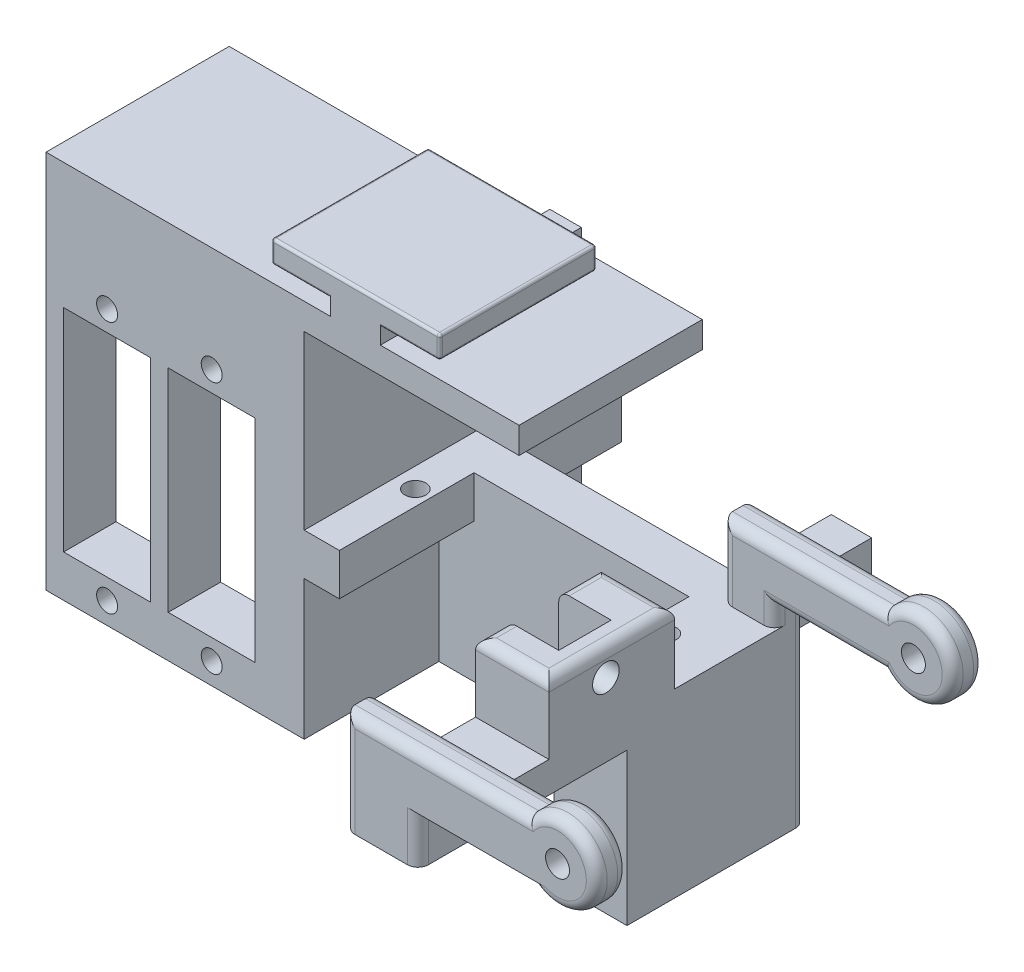
from build123d import *

# Parameters (mm, degrees)
SKETCH1_W                         = 21.64
SKETCH1_H                         = 36.2
CENTER_COLUMN_DEPTH               = 2.5
COLUMN_CAP_DEPTH                  = 55.1399964
ATTACHMENT_BLOCK_DEPTH            = 14.98
SKETCH6_W                         = 5
SKETCH6_H                         = 14.5
CENTRAL_EXTRUSION_DEPTH           = 33.79199998
WING_EXTRUSION_DEPTH              = 0.445
SKETCH10_W                        = 3.84999992
SKETCH10_H                        = 9
SERVO_TAB_EXTRUSION_DEPTH         = 9.48
SKETCH11_W                        = 9.94200006
SKETCH11_H                        = 17.28189
FRONT_TAB_EXTRUSION_DEPTH         = 11.63
SKETCH15_W                        = 10
SKETCH15_H                        = 9.5
CENTER_BLOCK_DEPTH                = 12
SKETCH16_W                        = 5
SKETCH16_H                        = 5.43
CENTER_CHASM_DEPTH                = 5
SKETCH17_R                        = 1.27
CENTER_HOLE_DEPTH                 = 60.602361575
SKETCH18_W                        = 10
SKETCH18_H                        = 2.9511752
HOLDER_ARM_DEPTH                  = 12.5
SKETCH19_W                        = 10
SKETCH19_H                        = 3
ELBOW_EXTRUSION_DEPTH             = 6.78
SKETCH27_W                        = 3
SKETCH27_H                        = 5
FOREARM_EXTRUSION_DEPTH           = 7.874
SKETCH28_R                        = 3.75
SKETCH28_R_2                      = 1.143
HAND_EXTRUSION_DEPTH              = 3
SKETCH23_W                        = 5
SKETCH23_H                        = 3
RIGHT_ELBOW_EXTRUSION_DEPTH       = 6.902
SKETCH24_W                        = 3
SKETCH24_H                        = 5
RIGHT_FOREARM_EXTRUSION_DEPTH     = 11.000000098
SKETCH25_R                        = 3.75
SKETCH25_R_2                      = 1.143
RIGHT_HAND_DEPTH                  = 3
SKETCH26_R                        = 1
SKETCH26_W                        = 8.3
SKETCH26_H                        = 20.2
REAR_SERVO_MOUNTS_DEPTH           = 70.999890195
NEW_BACK_DEPTH                    = 3
BOTTOM_SUPPORT_DEPTH              = 3
SKETCH31_W                        = 11.63
SKETCH31_H                        = 20.28189
RE_CUT_CENTRAL_CAVITY_DEPTH       = 3
SKETCH32_W                        = 9.48
SKETCH32_H                        = 9
FORM_LEFT_FRONT_REAR_BLOCK_DEPTH  = 3
SKETCH33_W                        = 20
SKETCH33_H                        = 17.28189
CREATE_CENTER_CAVITY_DEPTH        = 71.159701413
BOSS_EXTRUDE6_REACH               = 59.163
SKETCH34_W                        = 2.07
SKETCH34_H                        = 20.28189
EXTEND_WING_EXTRUSION_DEPTH       = 10.653199928
SKETCH37_W                        = 3.85
SKETCH37_H                        = 9
RIGHT_FRONT_REAR_EXTRUSION_DEPTH  = 9.48
SKETCH38_W                        = 3
SKETCH38_H                        = 12
TRIM_CENTER_BLOCK_DEPTH           = 6.5488248
SKETCH39_W                        = 3.85
SKETCH39_H                        = 9
RIGHT_FRONT_EXTENSION_DEPTH       = 7.33
TRIM_LEFT_ARM_DEPTH               = 4.7311752
SKETCH42_W                        = 23.84999992
SKETCH42_H                        = 3
CLOSE_BASE_PLATE_DEPTH            = 7.41
SKETCH43_W                        = 5.445
SKETCH43_H                        = 8.28189
SHAPE_LEFT_FRONT_BLOCK_DEPTH      = 3.84999992
SKETCH44_W                        = 3.84999992
SKETCH44_H                        = 4.555
FIX_LEFT_FRONT_CHIP_DEPTH         = 2.78189
SKETCH45_W                        = 3.85
SKETCH45_H                        = 9
ADJUST_FRONT_MOUNTING_BLOCK_DEPTH = 2.032
THICKEN_CENTER_BLOCK_DEPTH        = 2.15
SKETCH47_R                        = 1
FRONT_SERVO_MOUNTS_DEPTH          = 9
HAND_FILLETS_R                    = 1
CENTER_BLOCK_FILLET_R             = 1
CUT_EXTRUDE1_DEPTH                = 55.1399964
CUT_EXTRUDE2_START                = -30.499996
SKETCH49_W                        = 5
SKETCH49_H                        = 2.31
CUT_EXTRUDE2_DEPTH                = 30.499996
CUT_EXTRUDE3_DEPTH                = 10
CUT_EXTRUDE5_START                = -3
CUT_EXTRUDE5_DEPTH                = 3
SKETCH53_W                        = 5
SKETCH53_H                        = 2.31
CUT_EXTRUDE6_DEPTH                = 20.4999964
FILLET3_R                         = 0.25
SKETCH54_W                        = 3.85
SKETCH54_H                        = 9.362
SKETCH54_W_2                      = 3.84999992
SKETCH54_H_2                      = 12.855
CUT_EXTRUDE9_DEPTH                = 5
SKETCH55_W                        = 12.855
SKETCH55_H                        = 4
CUT_EXTRUDE10_DEPTH               = 0.5


with BuildPart() as part:
    # Sketch1 → Center Column (new, symmetric)
    with BuildSketch(Plane.XY):
        Rectangle(SKETCH1_W, SKETCH1_H)
    extrude(amount=CENTER_COLUMN_DEPTH, both=True)

    # Sketch2 → Column Cap (add)
    with BuildSketch(Plane.ZY.offset(10.82)):
        Polygon((-2.5, 18.1), (-14.98, 18.1), (-14.98, 15.6), (-10.5, 15.6), (-2.5, 10.98), (2.5, 10.98), (2.5, 18.1), align=None)
    extrude(amount=-COLUMN_CAP_DEPTH)

    # Sketch5 → Attachment Block (add)
    with BuildSketch(Plane.XY.offset(2.5)):
        Polygon((16.330000056, 18.1), (21.080000056, 18.1), (21.080000056, 19.600000018), (26.740000056, 19.600000018), (26.740000056, 21.750000018), (10.670000056, 21.750000018), (10.670000056, 19.6), (16.330000056, 19.6), align=None)
    extrude(amount=-ATTACHMENT_BLOCK_DEPTH)

    # Sketch6 → Central Extrusion (add)
    with BuildSketch(Plane(origin=(10.82, 0, 0), x_dir=(0, 0, -1), z_dir=(1, 0, 0))):
        with Locations((0, -10.85)):
            Rectangle(SKETCH6_W, SKETCH6_H)
    extrude(amount=CENTRAL_EXTRUSION_DEPTH)

    # Sketch7 → Wing Extrusion (add, symmetric)
    with BuildSketch(Plane(origin=(0, 0, -2.5), x_dir=(-1, 0, 0), z_dir=(0, 0, -1))):
        Polygon((-10.82, -18.1), (-10.82, -3.6), (-10.82, -0.81811), (-34.92, -0.81811), (-44.61199998, -0.81811), (-44.61199998, -18.1), (-40.253999996, -18.1), align=None)
    extrude(amount=WING_EXTRUSION_DEPTH, both=True)

    # Sketch10 → Servo Tab Extrusion (add)
    with BuildSketch(Plane(origin=(0, 0, -2.945), x_dir=(-1, 0, 0), z_dir=(0, 0, -1))):
        with Locations((-12.74499996, -5.31811)):
            Rectangle(SKETCH10_W, SKETCH10_H)
    extrude(amount=SERVO_TAB_EXTRUSION_DEPTH)

    # Sketch11 → Front Tab Extrusion (add)
    with BuildSketch(Plane(origin=(0, 0, -2.945), x_dir=(-1, 0, 0), z_dir=(0, 0, -1))):
        with Locations((-39.64099995, -9.459055)):
            Rectangle(SKETCH11_W, SKETCH11_H)
    extrude(amount=FRONT_TAB_EXTRUSION_DEPTH)

    # Sketch15 → Center Block (add)
    with BuildSketch(Plane.XY.offset(-2.055)):
        with Locations((42.611999818, 1.15)):
            Rectangle(SKETCH15_W, SKETCH15_H)
    extrude(amount=CENTER_BLOCK_DEPTH)

    # Sketch16 → Center Chasm (cut)
    with BuildSketch(Plane.ZY.offset(-37.611999818)):
        with Locations((4.509, 3.185)):
            Rectangle(SKETCH16_W, SKETCH16_H)
    extrude(amount=-CENTER_CHASM_DEPTH, mode=Mode.SUBTRACT)

    # Sketch17 → Center Hole (cut, through all)
    with BuildSketch(Plane.ZY.offset(-42.611999818)):
        with Locations((4.509, 3.4)):
            Circle(SKETCH17_R)
    extrude(amount=-CENTER_HOLE_DEPTH, mode=Mode.SUBTRACT)

    # Sketch18 → Holder Arm (add)
    with BuildSketch(Plane.XY.offset(9.945)):
        with Locations((42.611999818, -2.1244124)):
            Rectangle(SKETCH18_W, SKETCH18_H)
    extrude(amount=HOLDER_ARM_DEPTH)

    # Sketch19 → Elbow Extrusion (add)
    with BuildSketch(Plane(origin=(0, -0.6488248, 0), x_dir=(1, 0, 0), z_dir=(0, 1, 0))):
        with Locations((42.611999818, -20.945)):
            Rectangle(SKETCH19_W, SKETCH19_H)
    extrude(amount=ELBOW_EXTRUSION_DEPTH)

    # Sketch27 → Forearm Extrusion (add)
    with BuildSketch(Plane(origin=(47.611999818, 0, 0), x_dir=(0, 0, -1), z_dir=(1, 0, 0))):
        with Locations((-20.945, 3.6311752)):
            Rectangle(SKETCH27_W, SKETCH27_H)
    extrude(amount=FOREARM_EXTRUSION_DEPTH)

    # Sketch28 → Hand Extrusion (add)
    with BuildSketch(Plane.XY.offset(22.445)):
        with Locations((57.931999818, 3.6311752)):
            Circle(SKETCH28_R)
        with Locations((57.931999818, 3.6311752)):
            Circle(SKETCH28_R_2, mode=Mode.SUBTRACT)
    extrude(amount=-HAND_EXTRUSION_DEPTH)

    # Sketch23 → Right Elbow Extrusion (add)
    with BuildSketch(Plane(origin=(0, -0.81811, 0), x_dir=(1, 0, 0), z_dir=(0, 1, 0))):
        with Locations((42.11199998, 13.075)):
            Rectangle(SKETCH23_W, SKETCH23_H)
    extrude(amount=RIGHT_ELBOW_EXTRUSION_DEPTH)

    # Sketch24 → Right Forearm Extrusion (add)
    with BuildSketch(Plane(origin=(44.61199998, 0, 0), x_dir=(0, 0, -1), z_dir=(1, 0, 0))):
        with Locations((13.075, 3.58389)):
            Rectangle(SKETCH24_W, SKETCH24_H)
    extrude(amount=RIGHT_FOREARM_EXTRUSION_DEPTH)

    # Sketch25 → Right Hand (add)
    with BuildSketch(Plane(origin=(0, 0, -14.575), x_dir=(-1, 0, 0), z_dir=(0, 0, -1))):
        with Locations((-57.87000432, 3.58389)):
            Circle(SKETCH25_R)
        with Locations((-57.87000432, 3.58389)):
            Circle(SKETCH25_R_2, mode=Mode.SUBTRACT)
    extrude(amount=-RIGHT_HAND_DEPTH)

    # Sketch26 → Rear Servo Mounts (cut, through all)
    with BuildSketch(Plane(origin=(0, 0, -2.5), x_dir=(-1, 0, 0), z_dir=(0, 0, -1))):
        with Locations((-4.99, 8.05)):
            Circle(SKETCH26_R)
        with Locations((4.99, 8.05)):
            Circle(SKETCH26_R)
        with Locations((-4.99, -16.05)):
            Circle(SKETCH26_R)
        with Locations((4.99, -16.05)):
            Circle(SKETCH26_R)
        with Locations((4.99, -4)):
            Rectangle(SKETCH26_W, SKETCH26_H)
        with Locations((-4.99, -4)):
            Rectangle(SKETCH26_W, SKETCH26_H)
    extrude(amount=-REAR_SERVO_MOUNTS_DEPTH, mode=Mode.SUBTRACT)

    # Sketch29 → New Back (add)
    with BuildSketch(Plane(origin=(10.82, 0, 0), x_dir=(0, 0, -1), z_dir=(1, 0, 0))):
        Polygon((-2.5, 10.98), (19.745, 10.98), (19.745, -18.1), (2.945, -18.1), (-2.5, -18.1), align=None)
    extrude(amount=NEW_BACK_DEPTH)

    # Sketch30 → Bottom Support (add)
    with BuildSketch(Plane.XZ.offset(18.1)):
        Polygon((10.82, -19.745), (13.82, -19.745), (13.82, -2.945), (34.66999992, -2.945), (34.66999992, -14.575), (44.61199998, -14.575), (44.61199998, 2.5), (-10.82, 2.5), (-10.82, -2.5), (10.82, -2.5), align=None)
    extrude(amount=BOTTOM_SUPPORT_DEPTH)

    # Sketch31 → Re-cut Central Cavity (cut)
    with BuildSketch(Plane.ZY.offset(-34.66999992)):
        with Locations((-8.76, -10.959055)):
            Rectangle(SKETCH31_W, SKETCH31_H)
    extrude(amount=-RE_CUT_CENTRAL_CAVITY_DEPTH, mode=Mode.SUBTRACT)

    # Sketch32 → Form Left Front-Rear Block (add)
    with BuildSketch(Plane(origin=(14.66999992, 0, 0), x_dir=(0, 0, -1), z_dir=(1, 0, 0))):
        with Locations((7.685, -5.31811)):
            Rectangle(SKETCH32_W, SKETCH32_H)
    extrude(amount=FORM_LEFT_FRONT_REAR_BLOCK_DEPTH)

    # Sketch33 → Create Center Cavity (cut, through all)
    with BuildSketch(Plane(origin=(0, 0, -2.945), x_dir=(-1, 0, 0), z_dir=(0, 0, -1))):
        with Locations((-27.66999992, -9.459055)):
            Rectangle(SKETCH33_W, SKETCH33_H)
    extrude(amount=-CREATE_CENTER_CAVITY_DEPTH, mode=Mode.SUBTRACT)

    # Boss-Extrude6: up to this face of the body (flat: up to its plane)
    boss_extrude6_end = Plane(part.part.faces().sort_by_distance((37.66999992, -9.333369288, -3.619536704))[0])
    # Sketch34 → Boss-Extrude6 (add, up to the picked face)
    with BuildSketch(Plane(origin=(13.82, 0, 0), x_dir=(0, 0, -1), z_dir=(1, 0, 0)), mode=Mode.PRIVATE) as boss_extrude6_sk1:
        with Locations((11.39, -10.959055)):
            Rectangle(SKETCH34_W, SKETCH34_H)
    boss_extrude6_tool1 = split(extrude(boss_extrude6_sk1.sketch, amount=BOSS_EXTRUDE6_REACH, mode=Mode.PRIVATE), bisect_by=boss_extrude6_end, keep=Keep.BOTH, mode=Mode.PRIVATE)
    add(boss_extrude6_tool1.solids().sort_by(Axis((13.82, -10.959055, -11.39), (1, 0, 0)))[0])

    # Sketch35 → Extend Wing Extrusion (add)
    with BuildSketch(Plane(origin=(0, 0, -12.425), x_dir=(-1, 0, 0), z_dir=(0, 0, -1))):
        Polygon((-13.82, -0.81811), (-13.82, -21.1), (-10.819999904, -21.1), (-10.819999904, 10.98), (-13.82, 10.98), align=None)
    extrude(amount=EXTEND_WING_EXTRUSION_DEPTH)

    # Sketch37 → Right Front-Rear Extrusion (add)
    with BuildSketch(Plane(origin=(0, 0, -12.425), x_dir=(-1, 0, 0), z_dir=(0, 0, -1))):
        with Locations((-15.745, -5.31811)):
            Rectangle(SKETCH37_W, SKETCH37_H)
    extrude(amount=RIGHT_FRONT_REAR_EXTRUSION_DEPTH)

    # Sketch38 → Trim Center Block (cut)
    with BuildSketch(Plane(origin=(0, 5.9, 0), x_dir=(1, 0, 0), z_dir=(0, 1, 0))):
        with Locations((46.111999818, -3.945)):
            Rectangle(SKETCH38_W, SKETCH38_H)
    extrude(amount=-TRIM_CENTER_BLOCK_DEPTH, mode=Mode.SUBTRACT)

    # Sketch39 → Right Front Extension (add)
    with BuildSketch(Plane(origin=(0, 0, -14.575), x_dir=(-1, 0, 0), z_dir=(0, 0, -1))):
        with Locations((-39.59499992, -5.31811)):
            Rectangle(SKETCH39_W, SKETCH39_H)
    extrude(amount=RIGHT_FRONT_EXTENSION_DEPTH)

    # Sketch40 → Trim Left Arm (cut)
    with BuildSketch(Plane.XZ.offset(3.6)):
        Polygon((44.61199998, 2.5), (44.61199998, -2.055), (47.611999818, -2.055), (47.611999818, 22.445), (44.61199998, 22.445), align=None)
    extrude(amount=-TRIM_LEFT_ARM_DEPTH, mode=Mode.SUBTRACT)

    # Sketch42 → Close Base Plate (add)
    with BuildSketch(Plane(origin=(0, 0, -2.945), x_dir=(-1, 0, 0), z_dir=(0, 0, -1))):
        with Locations((-25.74499996, -19.6)):
            Rectangle(SKETCH42_W, SKETCH42_H)
    extrude(amount=CLOSE_BASE_PLATE_DEPTH)

    # Sketch43 → Shape Left Front Block (cut)
    with BuildSketch(Plane(origin=(17.66999992, 0, 0), x_dir=(0, 0, -1), z_dir=(1, 0, 0))):
        with Locations((0.2225, -13.959055)):
            Rectangle(SKETCH43_W, SKETCH43_H)
    extrude(amount=-SHAPE_LEFT_FRONT_BLOCK_DEPTH, mode=Mode.SUBTRACT)

    # Sketch44 → Fix Left Front Chip (add)
    with BuildSketch(Plane(origin=(0, -3.6, 0), x_dir=(1, 0, 0), z_dir=(0, 1, 0))):
        with Locations((15.74499996, -0.2225)):
            Rectangle(SKETCH44_W, SKETCH44_H)
    extrude(amount=FIX_LEFT_FRONT_CHIP_DEPTH)

    # Sketch45 → Adjust Front Mounting Block (add)
    with BuildSketch(Plane(origin=(0, 0, -21.905), x_dir=(-1, 0, 0), z_dir=(0, 0, -1))):
        Polygon((-13.82, -9.81811), (-13.82, -21.1), (-10.819999904, -21.1), (-10.819999904, 10.98), (-13.82, 10.98), (-13.82, -0.81811), (-17.67, -0.81811), (-17.67, -9.81811), align=None)
        with Locations((-39.59499992, -5.31811)):
            Rectangle(SKETCH45_W, SKETCH45_H)
    extrude(amount=ADJUST_FRONT_MOUNTING_BLOCK_DEPTH)

    # Sketch46 → Thicken Center Block (add)
    with BuildSketch(Plane(origin=(0, 0, -12.425), x_dir=(-1, 0, 0), z_dir=(0, 0, -1))):
        Polygon((-17.67, -9.81811), (-17.67, -0.81811), (-37.66999992, -0.81811), (-37.66999992, -21.1), (-13.82, -21.1), (-13.82, -9.81811), align=None)
    extrude(amount=THICKEN_CENTER_BLOCK_DEPTH)

    # Sketch47 → Front Servo Mounts (cut)
    with BuildSketch(Plane(origin=(0, -0.81811, 0), x_dir=(1, 0, 0), z_dir=(0, 1, 0))):
        with Locations(Location((39.61999992, 18.725, 0), (0, 0, 180))):
            Circle(SKETCH47_R)
        with Locations(Location((15.72, 18.725, 0), (0, 0, 180))):
            Circle(SKETCH47_R)
        with Locations(Location((15.71999992, 6.205, 0), (0, 0, 180))):
            Circle(SKETCH47_R)
        with Locations(Location((39.61999992, 6.205, 0), (0, 0, 180))):
            Circle(SKETCH47_R)
    extrude(amount=-FRONT_SERVO_MOUNTS_DEPTH, mode=Mode.SUBTRACT)

    # Hand Fillets
    hand_fillets_edges = [part.edges().sort_by_distance(p)[0] for p in [
        (61.681999818, 3.6311752, 19.445),
        (61.681999818, 3.6311752, 22.445),
        (46.374457332, 6.1311752, 22.445),
        (37.611999818, 2.6565326, 22.445),
        (44.61199998, -1.2344124, 22.445),
        (37.611999818, 2.7411752, 19.445),
        (46.374457332, 6.1311752, 19.445),
        (49.874457413, 1.1311752, 19.445),
        (44.61199998, 0.2411752, 19.445),
        (39.61199998, 2.63289, -11.575),
        (44.61199998, 0.13289, -11.575),
        (49.843459664, 1.08389, -11.575),
        (47.343459664, 6.08389, -11.575),
        (61.62000432, 3.58389, -11.575),
        (44.61199998, -10.008055, -14.575),
        (39.61199998, 2.63289, -14.575),
        (49.843459664, 1.08389, -14.575),
        (61.62000432, 3.58389, -14.575),
        (47.343459664, 6.08389, -14.575),
    ]]
    fillet(hand_fillets_edges, radius=HAND_FILLETS_R)

    # Center Block Fillet
    center_block_fillet_edges = [part.edges().sort_by_distance(p)[0] for p in [
        (37.611999818, 5.9, 8.477),
        (37.611999818, 5.9, -0.023),
        (41.111999818, 5.9, 9.945),
        (41.111999818, 5.9, -2.055),
        (44.611999818, 5.9, 3.945),
    ]]
    fillet(center_block_fillet_edges, radius=CENTER_BLOCK_FILLET_R)

    # Sketch48 → Cut-Extrude1 (cut)
    with BuildSketch(Plane.ZY.offset(10.82)):
        Polygon((-10.5, 15.6), (-2.5, 10.98), (-2.5, 15.6), align=None)
    extrude(amount=-CUT_EXTRUDE1_DEPTH, mode=Mode.SUBTRACT)

    # Sketch49 → Cut-Extrude2 (cut)
    with BuildSketch(Plane(origin=(44.3199964, 0, 0), x_dir=(0, 0, -1), z_dir=(1, 0, 0)).offset(CUT_EXTRUDE2_START)):
        with Locations((0, 12.135)):
            Rectangle(SKETCH49_W, SKETCH49_H)
    extrude(amount=CUT_EXTRUDE2_DEPTH, mode=Mode.SUBTRACT)

    # Sketch50 → Cut-Extrude3 (cut)
    with BuildSketch(Plane(origin=(44.3199964, 0, 0), x_dir=(0, 0, -1), z_dir=(1, 0, 0))):
        Polygon((-2.5, 18.1), (-2.5, 13.29), (2.5, 13.29), (2.5, 15.6), (14.98, 15.6), (14.98, 18.1), align=None)
    extrude(amount=-CUT_EXTRUDE3_DEPTH, mode=Mode.SUBTRACT)

    # Sketch52 → Cut-Extrude5 (cut)
    with BuildSketch(Plane.XZ.offset(21.1).offset(CUT_EXTRUDE5_START)):
        with BuildLine():
            Line((13.82, -14.575), (43.61199998, -14.575))
            ThreePointArc((43.61199998, -14.575), (44.319106761, -14.282106781), (44.61199998, -13.575))
            Line((44.61199998, -13.575), (44.61199998, 2.5))
            Line((44.61199998, 2.5), (-10.82, 2.5))
            Line((-10.82, 2.5), (-10.82, -2.5))
            Line((-10.82, -2.5), (10.82, -2.5))
            Line((10.82, -2.5), (10.819999904, -23.937))
            Line((10.819999904, -23.937), (13.82, -23.937))
            Line((13.82, -23.937), (13.82, -14.575))
        make_face()
    extrude(amount=CUT_EXTRUDE5_DEPTH, mode=Mode.SUBTRACT)

    # Sketch53 → Cut-Extrude6 (cut)
    with BuildSketch(Plane(origin=(34.3199964, 0, 0), x_dir=(0, 0, -1), z_dir=(1, 0, 0))):
        with Locations((0, 14.445)):
            Rectangle(SKETCH53_W, SKETCH53_H)
    extrude(amount=-CUT_EXTRUDE6_DEPTH, mode=Mode.SUBTRACT)

    # Fillet3
    fillet3_edges = [part.edges().sort_by_distance(p)[0] for p in [
        (13.500000056, 19.6, -12.48),
        (10.670000056, 20.675000009, -12.48),
        (10.670000056, 19.6, -4.99),
        (18.705000056, 21.750000018, -12.48),
        (10.670000056, 21.750000018, -4.99),
        (26.740000056, 20.675000018, -12.48),
        (26.740000056, 21.750000018, -4.99),
        (23.910000056, 19.600000018, -12.48),
        (26.740000056, 19.600000018, -4.99),
        (23.910000056, 19.600000018, 2.5),
        (26.740000056, 20.675000018, 2.5),
        (18.705000056, 21.750000018, 2.5),
        (10.670000056, 20.675000009, 2.5),
        (13.500000056, 19.6, 2.5),
    ]]
    fillet(fillet3_edges, radius=FILLET3_R)

    # Sketch54 → Cut-Extrude9 (cut)
    with BuildSketch(Plane.XZ.offset(9.81811)):
        with Locations((39.59499992, -19.256)):
            Rectangle(SKETCH54_W, SKETCH54_H)
        with Locations((15.745, -19.256)):
            Rectangle(SKETCH54_W, SKETCH54_H)
        with Locations((15.74499996, -3.9275)):
            Rectangle(SKETCH54_W_2, SKETCH54_H_2)
    extrude(amount=-CUT_EXTRUDE9_DEPTH, mode=Mode.SUBTRACT)

    # Sketch55 → Cut-Extrude10 (cut)
    with BuildSketch(Plane(origin=(17.66999992, 0, 0), x_dir=(0, 0, -1), z_dir=(1, 0, 0))):
        with Locations((3.9275, -2.81811)):
            Rectangle(SKETCH55_W, SKETCH55_H)
    extrude(amount=-CUT_EXTRUDE10_DEPTH, mode=Mode.SUBTRACT)


solid = part.part
